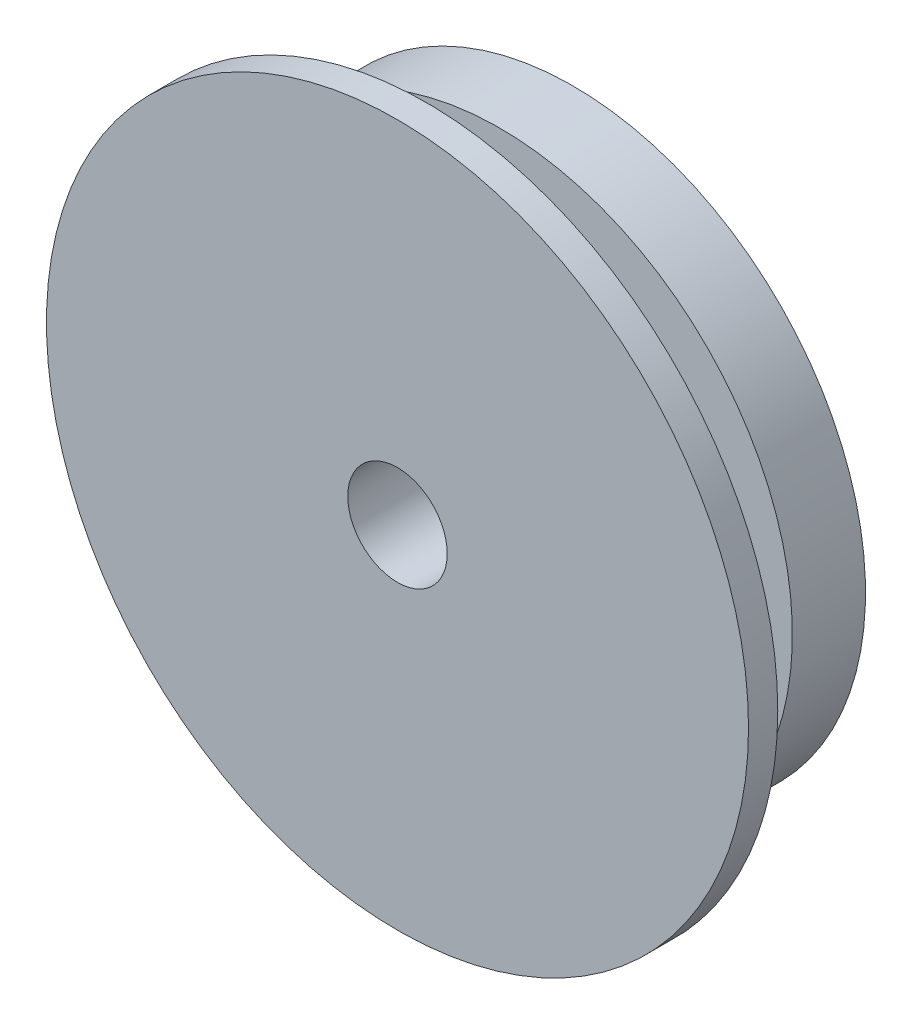
from build123d import *

# Parameters (mm, degrees)
CROQUIS1_R              = 25
CROQUIS1_R_2            = 11
SALIENTE_EXTRUIR1_DEPTH = 16.5
CROQUIS3_R              = 11
CROQUIS3_R_2            = 9.5
SALIENTE_EXTRUIR2_DEPTH = 10.5
SALIENTE_EXTRUIR3_START = -2
CROQUIS4_R              = 11
CROQUIS4_R_2            = 4
SALIENTE_EXTRUIR3_DEPTH = 2
SALIENTE_EXTRUIR4_START = -2.5
CROQUIS5_R              = 30
CROQUIS5_R_2            = 25
SALIENTE_EXTRUIR4_DEPTH = 2.5
CORTAR_EXTRUIR1_START   = 4
CROQUIS6_R              = 25
CROQUIS6_R_2            = 19
CORTAR_EXTRUIR1_DEPTH   = 4
SALIENTE_EXTRUIR5_REACH = 47.522
CROQUIS7_R              = 11
CROQUIS7_R_2            = 4.25
SALIENTE_EXTRUIR6_START = 2
CROQUIS8_R              = 6.1
CROQUIS8_R_2            = 4
SALIENTE_EXTRUIR6_DEPTH = 2
CROQUIS11_R             = 25
CROQUIS11_R_2           = 15
CORTAR_EXTRUIR2_DEPTH   = 1.5
CROQUIS13_R             = 4.25
CORTAR_EXTRUIR5_DEPTH   = 10
CORTAR_EXTRUIR6_START   = -10
CROQUIS14_R             = 4.25
CORTAR_EXTRUIR6_DEPTH   = 10


with BuildPart() as part:
    # Croquis1 → Saliente-Extruir1 (new body)
    with BuildSketch(Plane.XY):
        Circle(CROQUIS1_R)
        Circle(CROQUIS1_R_2, mode=Mode.SUBTRACT)
    extrude(amount=SALIENTE_EXTRUIR1_DEPTH)

    # Croquis3 → Saliente-Extruir2 (add, through all)
    with BuildSketch(Plane(origin=(0, 0, 6), x_dir=(-1, 0, 0), z_dir=(0, 0, -1))):
        Circle(CROQUIS3_R)
        Circle(CROQUIS3_R_2, mode=Mode.SUBTRACT)
    extrude(amount=-SALIENTE_EXTRUIR2_DEPTH)

    # Croquis4 → Saliente-Extruir3 (add)
    with BuildSketch(Plane.XY.offset(16.5).offset(SALIENTE_EXTRUIR3_START)):
        with Locations(Location((0, 0, 0), (0, 0, 180))):
            Circle(CROQUIS4_R)
        Circle(CROQUIS4_R_2, mode=Mode.SUBTRACT)
    extrude(amount=SALIENTE_EXTRUIR3_DEPTH)

    # Croquis5 → Saliente-Extruir4 (add)
    with BuildSketch(Plane.XY.offset(16.5).offset(SALIENTE_EXTRUIR4_START)):
        Circle(CROQUIS5_R)
        Circle(CROQUIS5_R_2, mode=Mode.SUBTRACT)
    extrude(amount=SALIENTE_EXTRUIR4_DEPTH)

    # Croquis6 → Cortar-Extruir1 (cut)
    with BuildSketch(Plane(origin=(0, 0, 11.75), x_dir=(-1, 0, 0), z_dir=(0, 0, -1)).offset(CORTAR_EXTRUIR1_START)):
        Circle(CROQUIS6_R)
        Circle(CROQUIS6_R_2, mode=Mode.SUBTRACT)
    extrude(amount=-CORTAR_EXTRUIR1_DEPTH, mode=Mode.SUBTRACT)

    # Croquis7 → Saliente-Extruir5 (add, up to next)
    with BuildSketch(Plane(origin=(0, 0, 0), x_dir=(-1, 0, 0), z_dir=(0, 0, -1)), mode=Mode.PRIVATE) as saliente_extruir5_sk1:
        Circle(CROQUIS7_R)
        Circle(CROQUIS7_R_2, mode=Mode.SUBTRACT)
    saliente_extruir5_tool1 = extrude(saliente_extruir5_sk1.sketch, amount=-SALIENTE_EXTRUIR5_REACH, mode=Mode.PRIVATE) - part.part
    add(saliente_extruir5_tool1.solids().sort_by_distance((10.688873, 0, 0))[0])

    # Croquis8 → Saliente-Extruir6 (add)
    with BuildSketch(Plane(origin=(0, 0, 0), x_dir=(-1, 0, 0), z_dir=(0, 0, -1)).offset(SALIENTE_EXTRUIR6_START)):
        with Locations(Location((0, 0, 0), (0, 0, 180))):
            Circle(CROQUIS8_R)
        with Locations(Location((0, 0, 0), (0, 0, 180))):
            Circle(CROQUIS8_R_2, mode=Mode.SUBTRACT)
    extrude(amount=-SALIENTE_EXTRUIR6_DEPTH)

    # Croquis11 → Cortar-Extruir2 (cut)
    with BuildSketch(Plane(origin=(0, 0, 0), x_dir=(-1, 0, 0), z_dir=(0, 0, -1))):
        Circle(CROQUIS11_R)
        Circle(CROQUIS11_R_2, mode=Mode.SUBTRACT)
    extrude(amount=-CORTAR_EXTRUIR2_DEPTH, mode=Mode.SUBTRACT)

    # Croquis13 → Cortar-Extruir5 (cut)
    with BuildSketch(Plane(origin=(0, 0, 14.5), x_dir=(-1, 0, 0), z_dir=(0, 0, -1))):
        Circle(CROQUIS13_R)
    extrude(amount=-CORTAR_EXTRUIR5_DEPTH, mode=Mode.SUBTRACT)

    # Croquis14 → Cortar-Extruir6 (cut)
    with BuildSketch(Plane.XY.offset(CORTAR_EXTRUIR6_START)):
        with Locations(Location((0, 0, 0), (0, 0, 180))):
            Circle(CROQUIS14_R)
    extrude(amount=CORTAR_EXTRUIR6_DEPTH, mode=Mode.SUBTRACT)


solid = part.part
